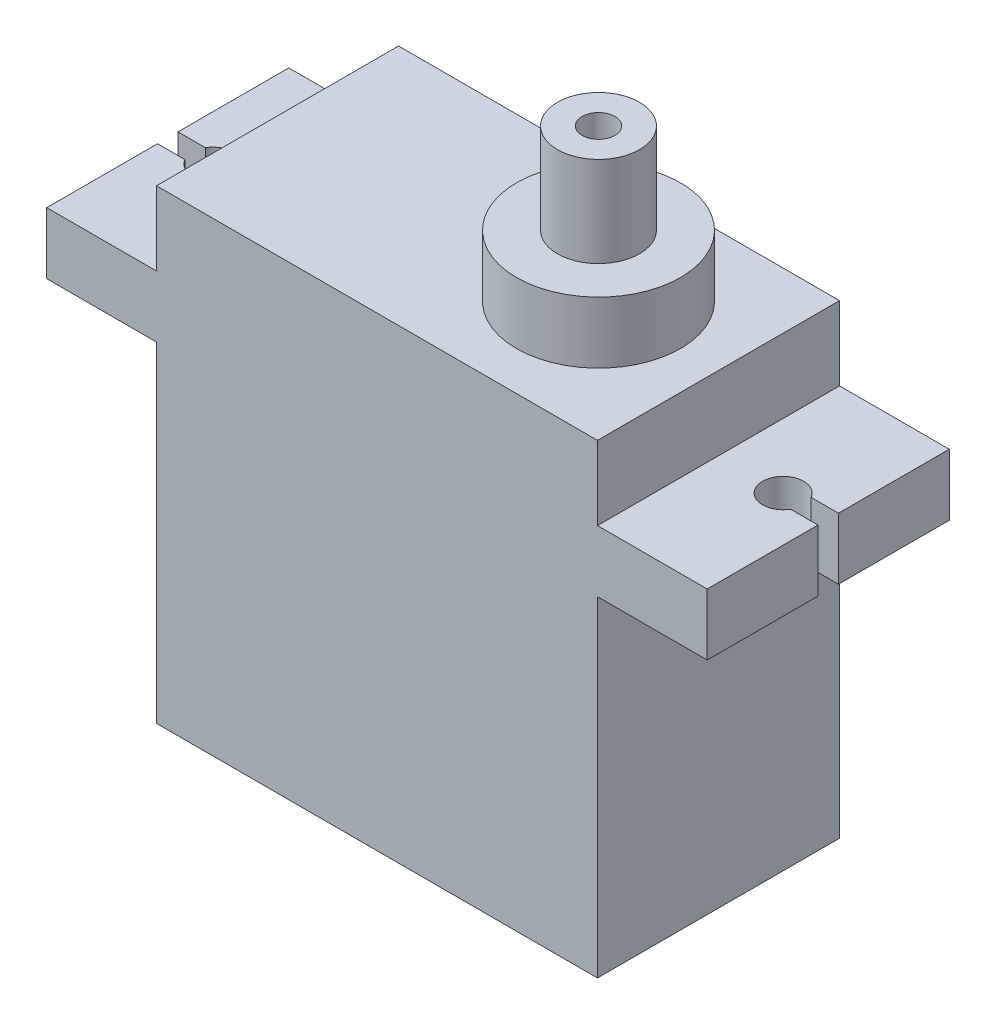
from build123d import *

# Parameters (mm, degrees)
SKETCH_1_W      = 21.5
SKETCH_1_H      = 11.8
EXTRUDE_1_DEPTH = 22.7
EXTRUDE_2_DEPTH = 3
SKETCH_3_R      = 2
SKETCH_3_R_2    = 0.8
EXTRUDE_3_DEPTH = 7.4
SKETCH_6_R      = 4
EXTRUDE_4_DEPTH = 3


with BuildPart() as part:
    # 草图1 → 凸台-拉伸1 (new body)
    with BuildSketch(Plane(origin=(0, 0, 0), x_dir=(1, 0, 0), z_dir=(0, 1, 0))):
        with Locations((10.75, -5.9)):
            Rectangle(SKETCH_1_W, SKETCH_1_H)
    extrude(amount=EXTRUDE_1_DEPTH)

    # 草图2 → 凸台-拉伸2 (add)
    with BuildSketch(Plane(origin=(0, 16.1, 0), x_dir=(1, 0, 0), z_dir=(0, 1, 0))):
        with BuildLine():
            Line((-5.35, -11.8), (0, -11.8))
            Line((0, -11.8), (0, 0))
            Line((0, 0), (-5.35, 0))
            Line((-5.35, 0), (-5.35, -5.4))
            Line((-5.35, -5.4), (-4.016025404, -5.4))
            ThreePointArc((-4.016025404, -5.4), (-2.15, -5.9), (-4.016025404, -6.4))
            Line((-4.016025404, -6.4), (-5.35, -6.4))
            Line((-5.35, -6.4), (-5.35, -11.8))
        make_face()
        with BuildLine():
            Line((26.85, 0), (21.5, 0))
            Line((21.5, 0), (21.5, -11.8))
            Line((21.5, -11.8), (26.85, -11.8))
            Line((26.85, -11.8), (26.85, -6.4))
            Line((26.85, -6.4), (25.516025404, -6.4))
            ThreePointArc((25.516025404, -6.4), (23.65, -5.9), (25.516025404, -5.4))
            Line((25.516025404, -5.4), (26.85, -5.4))
            Line((26.85, -5.4), (26.85, 0))
        make_face()
    extrude(amount=EXTRUDE_2_DEPTH)

    # 草图3 → 凸台-拉伸3 (add)
    with BuildSketch(Plane(origin=(0, 22.7, 0), x_dir=(1, 0, 0), z_dir=(0, 1, 0))):
        with Locations(Location((15.65, -5.9, 0), (0, 0, 270))):
            Circle(SKETCH_3_R)
        with Locations(Location((15.65, -5.9, 0), (0, 0, 270))):
            Circle(SKETCH_3_R_2, mode=Mode.SUBTRACT)
    extrude(amount=EXTRUDE_3_DEPTH)

    # 草图6 → 凸台-拉伸4 (add)
    with BuildSketch(Plane(origin=(0, 22.7, 0), x_dir=(1, 0, 0), z_dir=(0, 1, 0))):
        with Locations(Location((15.65, -5.9, 0), (0, 0, 270))):
            Circle(SKETCH_6_R)
    extrude(amount=EXTRUDE_4_DEPTH)


solid = part.part
